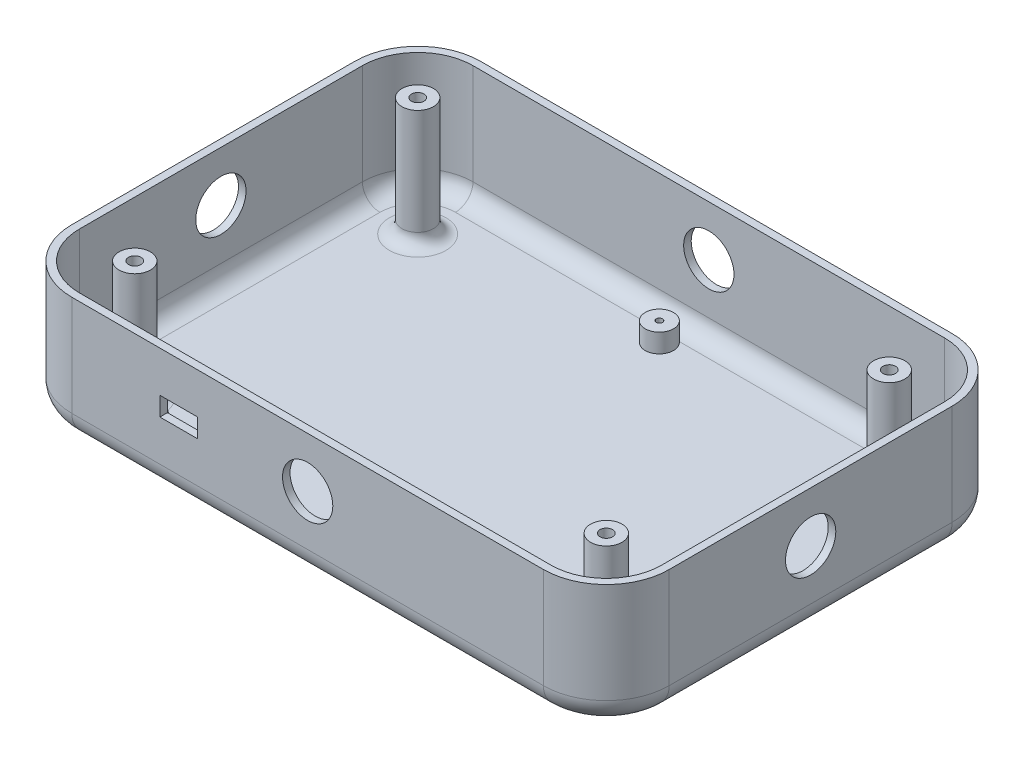
from build123d import *

# Parameters (mm, degrees)
SKETCH1_W            = 95
SKETCH1_H            = 65
BOSS_EXTRUDE1_DEPTH  = 20
FILLET1_R            = 10
FILLET2_R            = 4
SHELL1_T             = -1.2
SKETCH4_R            = 2.25
PLATINENZAPFEN_DEPTH = 3
SKETCH5_R            = 2.5
BOSS_EXTRUDE3_DEPTH  = 18.8
SKETCH7_R            = 1
CUT_EXTRUDE2_DEPTH   = 10
FILLET3_R            = 2
SKETCH8_R            = 0.5
CUT_EXTRUDE3_DEPTH   = 2
CUT_EXTRUDE4_REACH   = 118.833
SKETCH9_R            = 4
CUT_EXTRUDE1_REACH   = 118.833
SKETCH2_R            = 4
CUT_EXTRUDE5_REACH   = 118.833
SKETCH10_R           = 4
CUT_EXTRUDE6_REACH   = 118.833
SKETCH11_R           = 4
CUT_EXTRUDE7_REACH   = 118.833
SKETCH12_W           = 6
SKETCH12_H           = 3


with BuildPart() as part:
    # Sketch1 → Boss-Extrude1 (new body)
    with BuildSketch(Plane(origin=(0, 0, 0), x_dir=(1, 0, 0), z_dir=(0, 1, 0))):
        with Locations((47.5, 32.5)):
            Rectangle(SKETCH1_W, SKETCH1_H)
    extrude(amount=BOSS_EXTRUDE1_DEPTH)

    # Fillet1
    fillet1_edges = [part.edges().sort_by_distance(p)[0] for p in [
        (0, 10, -65),
        (95, 10, -65),
        (95, 10, 0),
        (0, 10, 0),
    ]]
    fillet(fillet1_edges, radius=FILLET1_R)

    # Fillet2
    fillet2_edges = [part.edges().sort_by_distance(p)[0] for p in [
        (95, 0, -32.5),
        (0, 0, -32.5),
        (47.5, 0, -65),
        (47.5, 0, 0),
        (2.928932188, 0, -2.928932188),
        (2.928932188, 0, -62.071067812),
        (92.071067812, 0, -62.071067812),
        (92.071067812, 0, -2.928932188),
    ]]
    fillet(fillet2_edges, radius=FILLET2_R)

    # Shell1
    shell1_openings = [part.faces().sort_by_distance(p)[0] for p in [
        (47.5, 20, -32.5),
    ]]
    offset(amount=SHELL1_T, openings=shell1_openings, kind=Kind.INTERSECTION)

    # Sketch4 → Platinenzapfen (add)
    with BuildSketch(Plane(origin=(0, 1.2, 0), x_dir=(1, 0, 0), z_dir=(0, 1, 0))):
        with Locations(Location((44.14, 59.3, 0), (0, 0, 130.92606327))):
            Circle(SKETCH4_R)
        with Locations(Location((16.2, 5.96, 0), (0, 0, 240.588015604))):
            Circle(SKETCH4_R)
    extrude(amount=PLATINENZAPFEN_DEPTH)

    # Sketch5 → Boss-Extrude3 (add)
    with BuildSketch(Plane(origin=(0, 1.2, 0), x_dir=(1, 0, 0), z_dir=(0, 1, 0))):
        with Locations(Location((10, 55, 0), (0, 0, 90))):
            Circle(SKETCH5_R)
        with Locations(Location((85, 55, 0), (0, 0, 90))):
            Circle(SKETCH5_R)
        with Locations(Location((85, 10, 0), (0, 0, 90))):
            Circle(SKETCH5_R)
        with Locations(Location((10, 10, 0), (0, 0, 90))):
            Circle(SKETCH5_R)
    extrude(amount=BOSS_EXTRUDE3_DEPTH)

    # Sketch7 → Cut-Extrude2 (cut)
    with BuildSketch(Plane(origin=(0, 20, 0), x_dir=(1, 0, 0), z_dir=(0, 1, 0))):
        with Locations(Location((10, 55, 0), (0, 0, 270))):
            Circle(SKETCH7_R)
        with Locations(Location((85, 55, 0), (0, 0, 270))):
            Circle(SKETCH7_R)
        with Locations(Location((85, 10, 0), (0, 0, 270))):
            Circle(SKETCH7_R)
        with Locations(Location((10, 10, 0), (0, 0, 270))):
            Circle(SKETCH7_R)
    extrude(amount=-CUT_EXTRUDE2_DEPTH, mode=Mode.SUBTRACT)

    # Fillet3
    fillet3_edges = [part.edges().sort_by_distance(p)[0] for p in [
        (10, 1.2, -52.5),
        (85, 1.2, -52.5),
        (85, 1.2, -7.5),
        (10, 1.2, -7.5),
    ]]
    fillet(fillet3_edges, radius=FILLET3_R)

    # Sketch8 → Cut-Extrude3 (cut)
    with BuildSketch(Plane(origin=(0, 4.2, 0), x_dir=(1, 0, 0), z_dir=(0, 1, 0))):
        with Locations(Location((44.14, 59.3, 0), (0, 0, 270))):
            Circle(SKETCH8_R)
        with Locations(Location((16.2, 5.96, 0), (0, 0, 270))):
            Circle(SKETCH8_R)
    extrude(amount=-CUT_EXTRUDE3_DEPTH, mode=Mode.SUBTRACT)

    # Sketch9 → Cut-Extrude4 (cut, up to next)
    with BuildSketch(Plane(origin=(0, 0, -65), x_dir=(-1, 0, 0), z_dir=(0, 0, -1)), mode=Mode.PRIVATE) as cut_extrude4_sk1:
        with Locations((-47.5, 12)):
            Circle(SKETCH9_R)
    cut_extrude4_tool1 = extrude(cut_extrude4_sk1.sketch, amount=-CUT_EXTRUDE4_REACH, mode=Mode.PRIVATE) & part.part
    add(cut_extrude4_tool1.solids().sort_by_distance((47.5, 12, -65))[0], mode=Mode.SUBTRACT)

    # Sketch2 → Cut-Extrude1 (cut, up to next)
    with BuildSketch(Plane.XY, mode=Mode.PRIVATE) as cut_extrude1_sk1:
        with Locations(Location((47.5, 12, 0), (0, 0, 180))):
            Circle(SKETCH2_R)
    cut_extrude1_tool1 = extrude(cut_extrude1_sk1.sketch, amount=-CUT_EXTRUDE1_REACH, mode=Mode.PRIVATE) & part.part
    add(cut_extrude1_tool1.solids().sort_by_distance((47.5, 12, 0))[0], mode=Mode.SUBTRACT)

    # Sketch10 → Cut-Extrude5 (cut, up to next)
    with BuildSketch(Plane.ZY, mode=Mode.PRIVATE) as cut_extrude5_sk1:
        with Locations((-32.5, 12)):
            Circle(SKETCH10_R)
    cut_extrude5_tool1 = extrude(cut_extrude5_sk1.sketch, amount=-CUT_EXTRUDE5_REACH, mode=Mode.PRIVATE) & part.part
    add(cut_extrude5_tool1.solids().sort_by_distance((0, 12, -32.5))[0], mode=Mode.SUBTRACT)

    # Sketch11 → Cut-Extrude6 (cut, up to next)
    with BuildSketch(Plane(origin=(95, 0, 0), x_dir=(0, 0, -1), z_dir=(1, 0, 0)), mode=Mode.PRIVATE) as cut_extrude6_sk1:
        with Locations(Location((32.5, 12, 0), (0, 0, 180))):
            Circle(SKETCH11_R)
    cut_extrude6_tool1 = extrude(cut_extrude6_sk1.sketch, amount=-CUT_EXTRUDE6_REACH, mode=Mode.PRIVATE) & part.part
    add(cut_extrude6_tool1.solids().sort_by_distance((95, 12, -32.5))[0], mode=Mode.SUBTRACT)

    # Sketch12 → Cut-Extrude7 (cut, up to next)
    with BuildSketch(Plane.XY, mode=Mode.PRIVATE) as cut_extrude7_sk1:
        with Locations((27, 12)):
            Rectangle(SKETCH12_W, SKETCH12_H)
    cut_extrude7_tool1 = extrude(cut_extrude7_sk1.sketch, amount=-CUT_EXTRUDE7_REACH, mode=Mode.PRIVATE) & part.part
    add(cut_extrude7_tool1.solids().sort_by_distance((27, 12, 0))[0], mode=Mode.SUBTRACT)


solid = part.part
